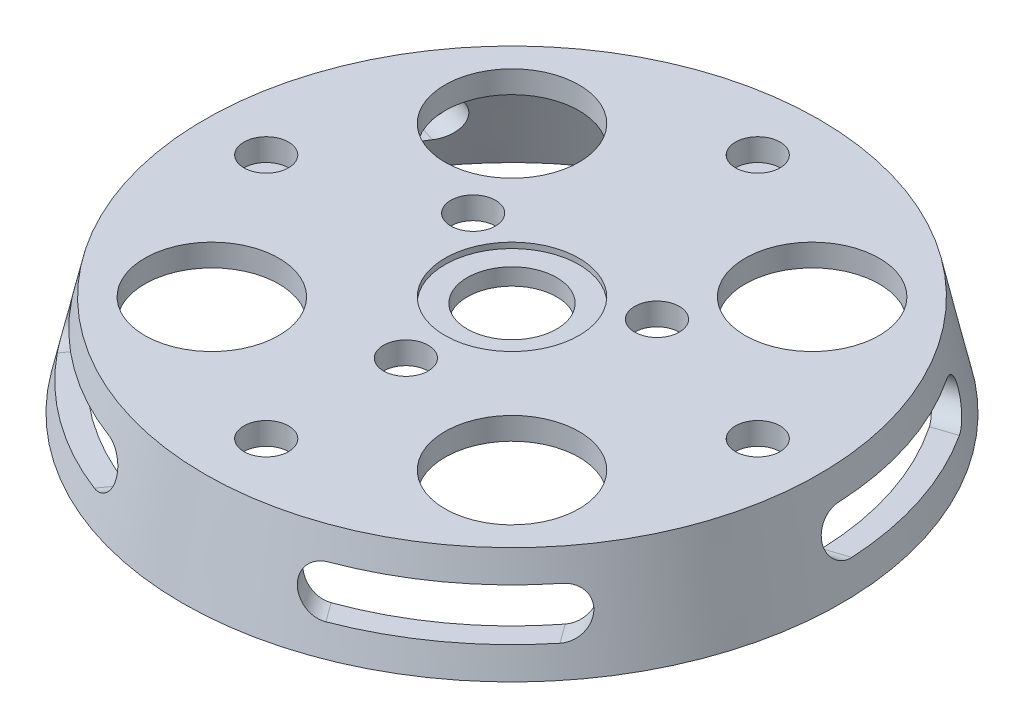
from build123d import *

# Parameters (mm, degrees)
SKETCH1_R          = 29.5
SKETCH2_R          = 27.5
SHELL1_T           = -2
CUT_EXTRUDE1_DEPTH = 30
CIRPATTERN1_COUNT  = 5
SKETCH4_R          = 2
SKETCH4_R_2        = 6
SKETCH4_R_3        = 4
CUT_EXTRUDE2_DEPTH = 2
SKETCH5_R          = 6
CUT_EXTRUDE3_DEPTH = 0.5


with BuildPart() as part:
    # Sketch1 → Loft1 section 0
    with BuildSketch(Plane(origin=(0, 0, 0), x_dir=(1, 0, 0), z_dir=(0, 1, 0))):
        Circle(SKETCH1_R)
    # Sketch2 → Loft1 section 1
    with BuildSketch(Plane(origin=(0, 9, 0), x_dir=(1, 0, 0), z_dir=(0, 1, 0))):
        Circle(SKETCH2_R)
    loft()

    # Shell1
    shell1_openings = [part.faces().sort_by_distance(p)[0] for p in [
        (0, 0, 0),
    ]]
    offset(amount=SHELL1_T, openings=shell1_openings, kind=Kind.INTERSECTION)

    # Sketch3 → Cut-Extrude1 (cut)
    with BuildSketch(Plane.XY):
        with BuildLine():
            Line((-7.5, 6.5), (7.5, 6.5))
            ThreePointArc((7.5, 6.5), (9.5, 4.5), (7.5, 2.5))
            Line((7.5, 2.5), (-7.5, 2.5))
            ThreePointArc((-7.5, 2.5), (-9.5, 4.5), (-7.5, 6.5))
        make_face()
    cut_extrude1 = extrude(amount=-CUT_EXTRUDE1_DEPTH, mode=Mode.SUBTRACT)

    # CirPattern1: Cut-Extrude1 ×5 about axis
    cirpattern1_axis = Axis((0, 9, 0), (0, -1, 0))
    for i in range(1, CIRPATTERN1_COUNT):
        add(cut_extrude1.rotate(cirpattern1_axis, i * 360 / CIRPATTERN1_COUNT), mode=Mode.SUBTRACT)

    # Sketch4 → Cut-Extrude2 (cut)
    with BuildSketch(Plane(origin=(0, 9, 0), x_dir=(1, 0, 0), z_dir=(0, 1, 0))):
        with Locations(Location((0, -22, 0), (0, 0, 270))):
            Circle(SKETCH4_R)
        with Locations(Location((-22, 0, 0), (0, 0, 270))):
            Circle(SKETCH4_R)
        with Locations(Location((0, 22, 0), (0, 0, 270))):
            Circle(SKETCH4_R)
        with Locations(Location((22, 0, 0), (0, 0, 270))):
            Circle(SKETCH4_R)
        with Locations(Location((13.435028843, 13.435028843, 0), (0, 0, 270))):
            Circle(SKETCH4_R_2)
        with Locations(Location((13.435028843, -13.435028843, 0), (0, 0, 270))):
            Circle(SKETCH4_R_2)
        with Locations(Location((-13.435028843, -13.435028843, 0), (0, 0, 270))):
            Circle(SKETCH4_R_2)
        with Locations(Location((-13.435028843, 13.435028843, 0), (0, 0, 270))):
            Circle(SKETCH4_R_2)
        with Locations(Location((0, 0, 0), (0, 0, 270))):
            Circle(SKETCH4_R_3)
        with Locations(Location((0, -9.5, 0), (0, 0, 270))):
            Circle(SKETCH4_R)
        with Locations(Location((-8.227241336, 4.75, 0), (0, 0, 270))):
            Circle(SKETCH4_R)
        with Locations(Location((8.227241336, 4.75, 0), (0, 0, 270))):
            Circle(SKETCH4_R)
    extrude(amount=-CUT_EXTRUDE2_DEPTH, mode=Mode.SUBTRACT)

    # Sketch5 → Cut-Extrude3 (cut)
    with BuildSketch(Plane(origin=(0, 9, 0), x_dir=(1, 0, 0), z_dir=(0, 1, 0))):
        with Locations(Location((0, 0, 0), (0, 0, 270))):
            Circle(SKETCH5_R)
    extrude(amount=-CUT_EXTRUDE3_DEPTH, mode=Mode.SUBTRACT)


solid = part.part
